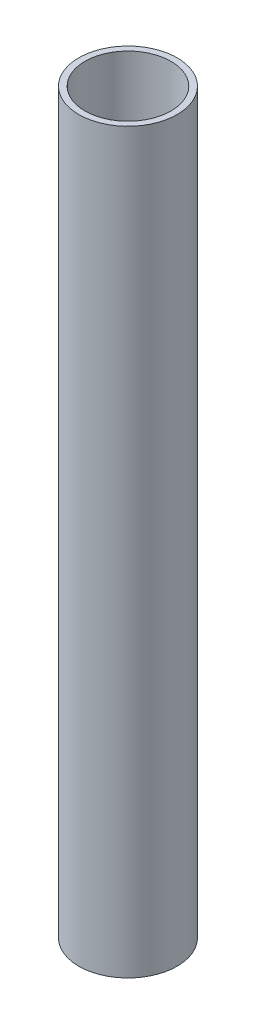
from build123d import *

# Parameters (mm, degrees)
SKETCH1_R           = 8
SKETCH1_R_2         = 7
BOSS_EXTRUDE1_DEPTH = 120


with BuildPart() as part:
    # Sketch1 → Boss-Extrude1 (new body)
    with BuildSketch(Plane(origin=(0, 0, 0), x_dir=(1, 0, 0), z_dir=(0, 1, 0))):
        with Locations(Location((0, 0, 0), (0, 0, 270))):
            Circle(SKETCH1_R)
        with Locations(Location((0, 0, 0), (0, 0, 270))):
            Circle(SKETCH1_R_2, mode=Mode.SUBTRACT)
    extrude(amount=BOSS_EXTRUDE1_DEPTH)


solid = part.part
